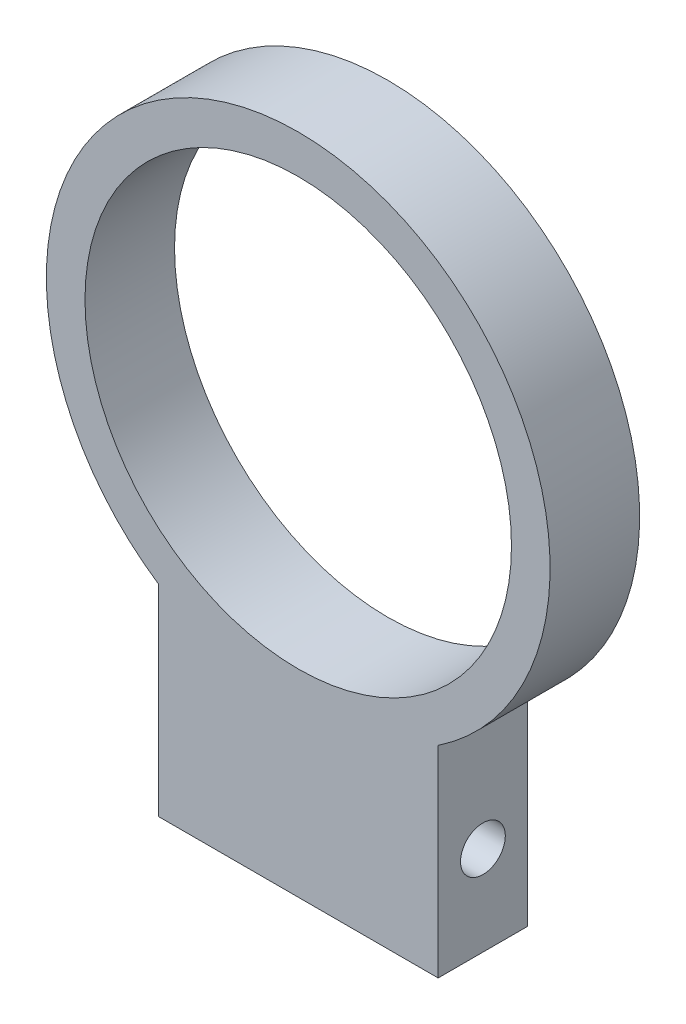
from build123d import *

# Parameters (mm, degrees)
SKETCH_1_R          = 19.05
EXTRUDE_1_DEPTH     = 8
CUT_EXTRUDE_1_REACH = 53.347
SKETCH_2_R          = 2


with BuildPart() as part:
    # 스케치1 → 보스-돌출1 (new body)
    with BuildSketch(Plane.XY):
        with BuildLine():
            Line((-12.5, -18.708286934), (-12.5, -36.708286934))
            Line((-12.5, -36.708286934), (12.5, -36.708286934))
            Line((12.5, -36.708286934), (12.5, -18.708286934))
            ThreePointArc((12.5, -18.708286934), (0, 22.5), (-12.5, -18.708286934))
        make_face()
        Circle(SKETCH_1_R, mode=Mode.SUBTRACT)
    extrude(amount=EXTRUDE_1_DEPTH)

    # 스케치2 → 컷-돌출1 (cut, up to next)
    with BuildSketch(Plane.ZY.offset(12.5), mode=Mode.PRIVATE) as cut_extrude_1_sk1:
        with Locations(Location((4, -28.708286934, 0), (0, 0, 270))):
            Circle(SKETCH_2_R)
    cut_extrude_1_tool1 = extrude(cut_extrude_1_sk1.sketch, amount=-CUT_EXTRUDE_1_REACH, mode=Mode.PRIVATE) & part.part
    add(cut_extrude_1_tool1.solids().sort_by_distance((-12.5, -28.708287, 4))[0], mode=Mode.SUBTRACT)


solid = part.part
